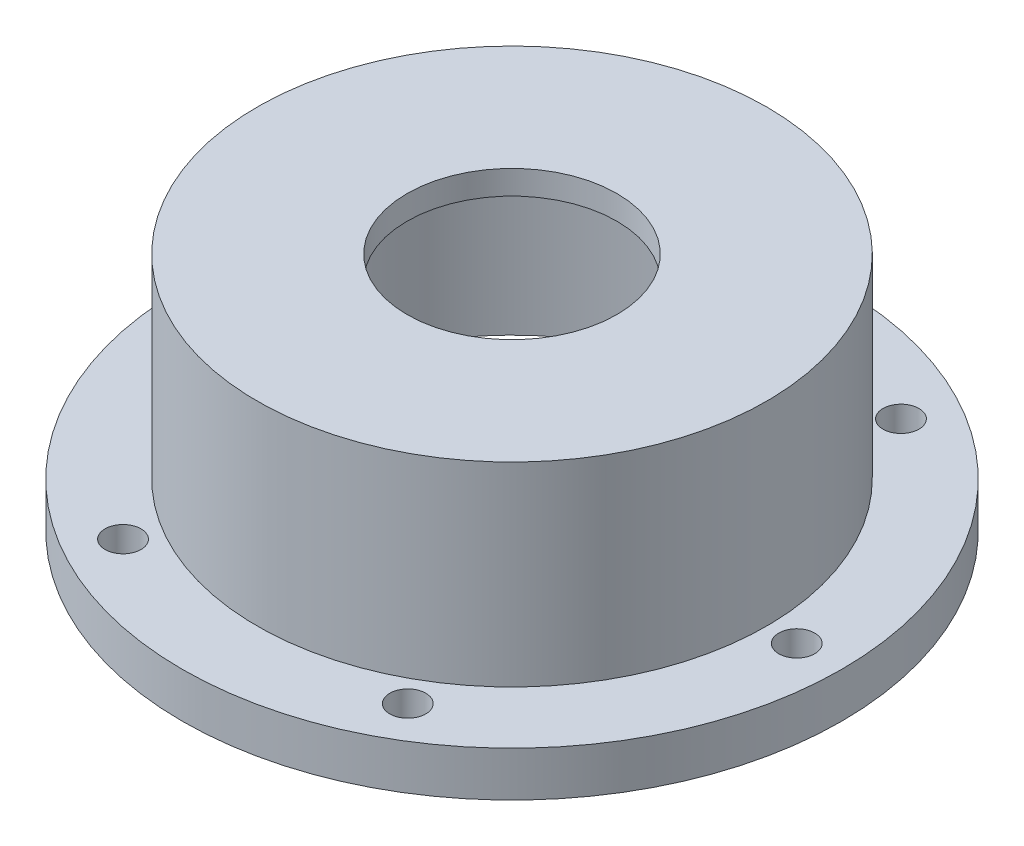
from build123d import *

# Parameters (mm, degrees)
SKETCH2_R                  = 35
CUT_EXTRUDE1_DEPTH         = 8
F_12_0_12_DIAMETER_HOLE1_D = 12
SKETCH7_R                  = 10
CUT_EXTRUDE2_DEPTH         = 3


with BuildPart() as part:
    # Sketch1 → Revolve1 (revolve)
    with BuildSketch(Plane.XY, mode=Mode.PRIVATE) as revolve1_sk:
        Polygon((-80, 72), (0, 72), (0, 80), (-85, 80), (-85, 15), (-110, 15), (-110, 0), (-80, 0), align=None)
    revolve(revolve1_sk.sketch.rotate(Axis((0, 0, 0), (0, 1, 0)), 270), axis=Axis((0, 0, 0), (0, 1, 0)))

    # Sketch2 → Cut-Extrude1 (cut)
    with BuildSketch(Plane(origin=(0, 80, 0), x_dir=(1, 0, 0), z_dir=(0, 1, 0))):
        with Locations(Location((0, 0, 0), (0, 0, 270))):
            Circle(SKETCH2_R)
    extrude(amount=-CUT_EXTRUDE1_DEPTH, mode=Mode.SUBTRACT)

    # Ø12.0 (12) Diameter Hole1 (through all)
    with Locations(Plane(origin=(0, 15, 0), x_dir=(1, 0, 0), z_dir=(0, 1, 0))):
        with Locations((-47.5, -82.27241336), (-95, 0), (-47.5, 82.27241336), (47.5, 82.27241336), (95, 0), (47.5, -82.27241336)):
            Hole(F_12_0_12_DIAMETER_HOLE1_D / 2)

    # Sketch7 → Cut-Extrude2 (cut)
    with BuildSketch(Plane.XZ.offset(-72)):
        with Locations(Location((0, 58.5, 0), (0, 0, 270))):
            Circle(SKETCH7_R)
        with Locations(Location((58.5, 0, 0), (0, 0, 270))):
            Circle(SKETCH7_R)
        with Locations(Location((0, -58.5, 0), (0, 0, 270))):
            Circle(SKETCH7_R)
        with Locations(Location((-58.5, 0, 0), (0, 0, 270))):
            Circle(SKETCH7_R)
    extrude(amount=-CUT_EXTRUDE2_DEPTH, mode=Mode.SUBTRACT)


solid = part.part
